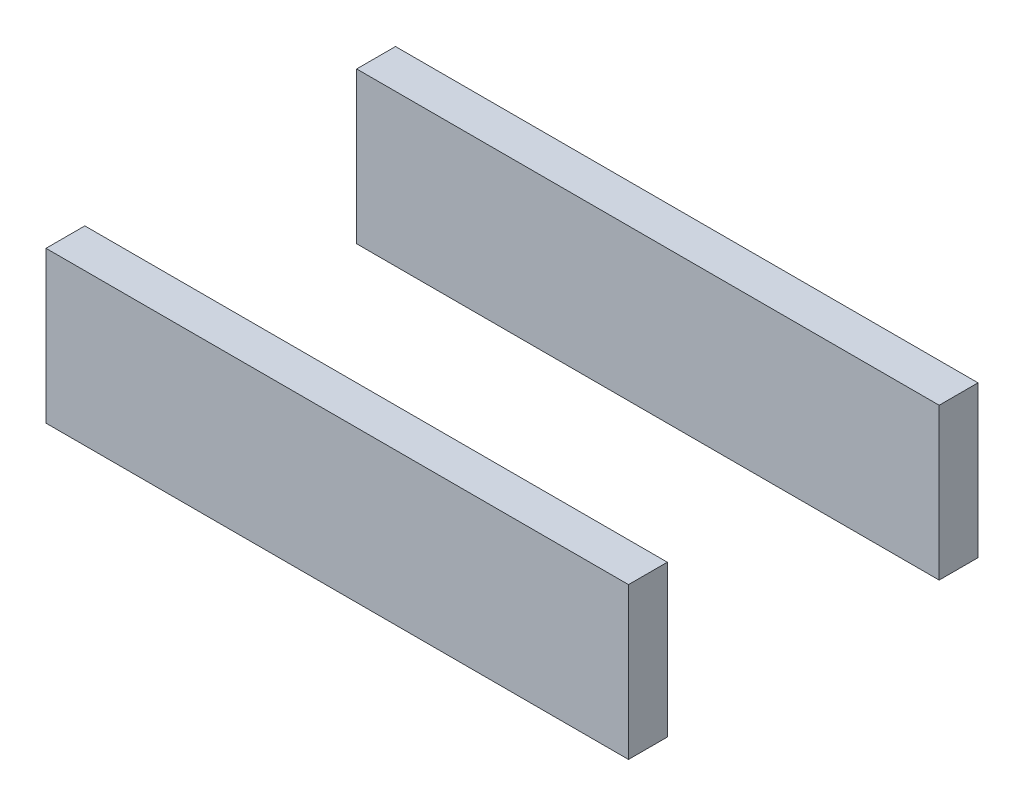
from build123d import *

# Parameters (mm, degrees)
SKETCH1_W             = 38.1
SKETCH1_H             = 2.54
BOSS_EXTRUDE1_DEPTH   = 9.906
BOSS_EXTRUDE1_2_DEPTH = 9.906


with BuildPart() as part:
    # Sketch1 → Boss-Extrude1 (new body)
    with BuildSketch(Plane(origin=(0, 0, 0), x_dir=(1, 0, 0), z_dir=(0, 1, 0))):
        with Locations((-6.519333333, 36.068)):
            Rectangle(SKETCH1_W, SKETCH1_H)
    extrude(amount=BOSS_EXTRUDE1_DEPTH)


with BuildPart() as body_2:
    # Sketch1 → Boss-Extrude1 2 (new body)
    with BuildSketch(Plane(origin=(0, 0, 0), x_dir=(1, 0, 0), z_dir=(0, 1, 0))):
        with Locations((-6.519333333, 15.748)):
            Rectangle(SKETCH1_W, SKETCH1_H)
    extrude(amount=BOSS_EXTRUDE1_2_DEPTH)


solid = Compound([part.part, body_2.part])
